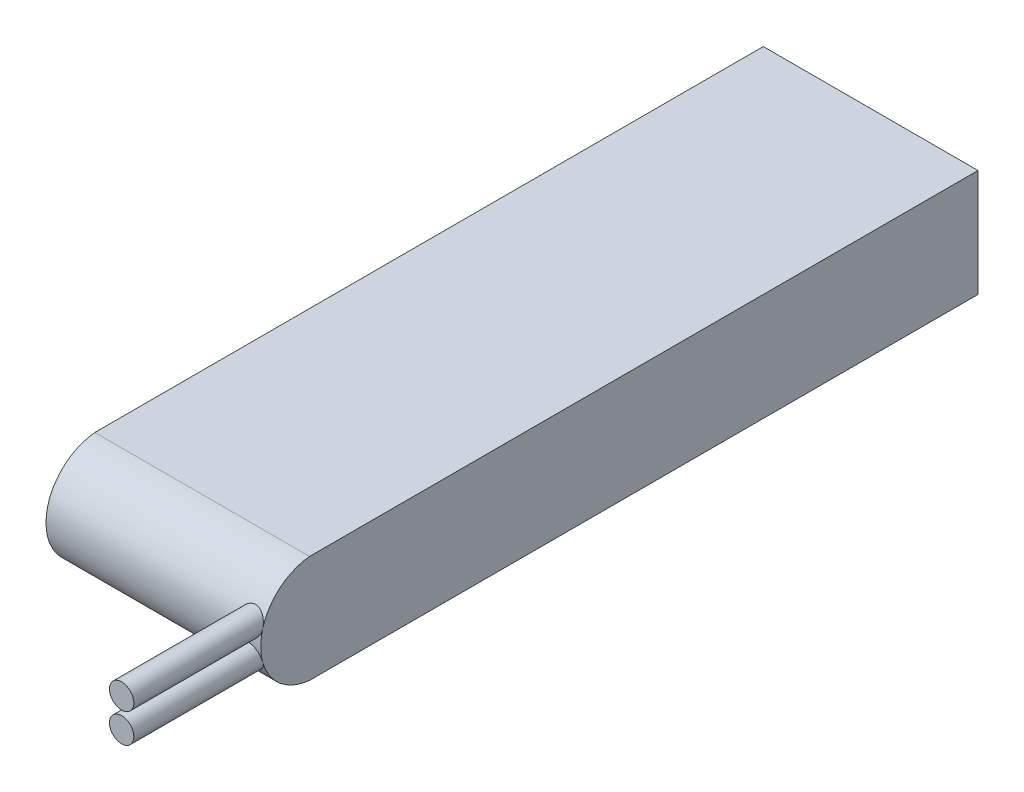
from build123d import *

# Parameters (mm, degrees)
ESQUISSE1_W        = 44
ESQUISSE1_H        = 22
BOSS_EXTRU_1_DEPTH = 137
BOSS_EXTRU_2_DEPTH = 44
ESQUISSE3_R        = 2.5
BOSS_EXTRU_3_DEPTH = 173


with BuildPart() as part:
    # Esquisse1 → Boss.-Extru.1 (new body)
    with BuildSketch(Plane.XY):
        with Locations((22, 11)):
            Rectangle(ESQUISSE1_W, ESQUISSE1_H)
    extrude(amount=BOSS_EXTRU_1_DEPTH)

    # Esquisse2 → Boss.-Extru.2 (add)
    with BuildSketch(Plane(origin=(44, 0, 0), x_dir=(0, 0, -1), z_dir=(1, 0, 0))):
        with BuildLine():
            Line((-137, 22), (-137, 0))
            ThreePointArc((-137, 0), (-147, 11), (-137, 22))
        make_face()
    extrude(amount=-BOSS_EXTRU_2_DEPTH)

    # Esquisse3 → Boss.-Extru.3 (add)
    with BuildSketch(Plane(origin=(0, 0, 0), x_dir=(-1, 0, 0), z_dir=(0, 0, -1))):
        with Locations((-41.5, 14)):
            Circle(ESQUISSE3_R)
        with Locations((-41.5, 8)):
            Circle(ESQUISSE3_R)
    extrude(amount=-BOSS_EXTRU_3_DEPTH)


solid = part.part
